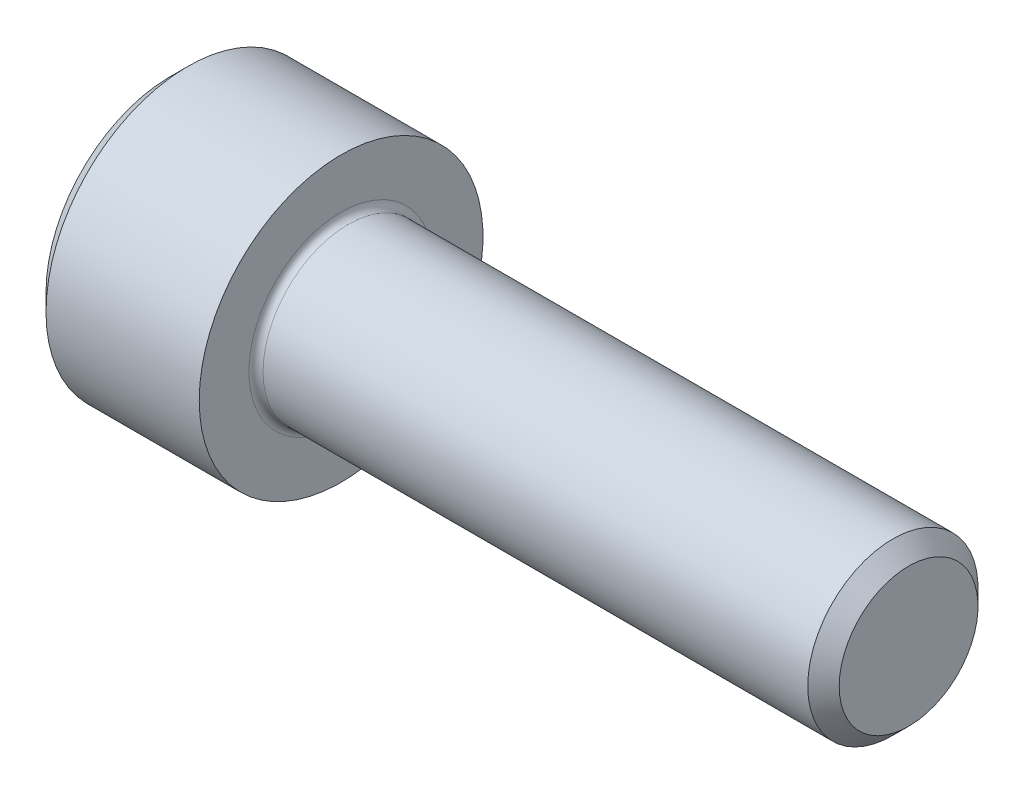
from build123d import *

# Parameters (mm, degrees)
FILLET1_R   = 0.25
HEX_2_DEPTH = 3


with BuildPart() as part:
    # BodySke → Base-Revolve (revolve)
    with BuildSketch(Plane.XY, mode=Mode.PRIVATE) as base_revolve_sk:
        Polygon((0, 0), (0, 4.4), (0.6, 5), (6, 5), (6, 3), (25.4455, 3), (26, 2.4455), (26, 0), align=None)
    revolve(base_revolve_sk.sketch.rotate(Axis((-31.75, 0, 0), (1, 0, 0)), 90), axis=Axis((-31.75, 0, 0), (1, 0, 0)))

    # Fillet1
    fillet1_edges = [part.edges().sort_by_distance(p)[0] for p in [
        (6, 0, -3),
    ]]
    fillet(fillet1_edges, radius=FILLET1_R)

    # Sketch2 → Hex-PreBroach (revolve, cut)
    with BuildSketch(Plane.XY, mode=Mode.PRIVATE) as hex_prebroach_sk:
        Polygon((0, 2.542), (3, 2.542), (4.467624384, 0), (0, 0), align=None)
    revolve(hex_prebroach_sk.sketch.rotate(Axis((0, 0, 0), (1, 0, 0)), 90), axis=Axis((0, 0, 0), (1, 0, 0)), mode=Mode.SUBTRACT)

    # Sketch3 → Hex 2 (cut)
    with BuildSketch(Plane(origin=(0, 0, 0), x_dir=(0, 0.500000000000001, 0.866025403784438), z_dir=(-1, 0, 0))):
        Polygon((1.467624384, 2.542), (-1.467624384, 2.542), (-2.935248769, 0), (-1.467624384, -2.542), (1.467624384, -2.542), (2.935248769, 0), align=None)
    extrude(amount=-HEX_2_DEPTH, mode=Mode.SUBTRACT)


solid = part.part
